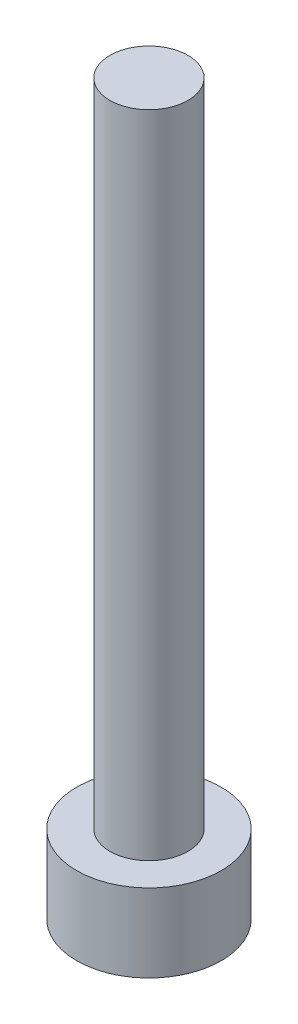
from build123d import *

# Parameters (mm, degrees)
SKETCH1_R           = 2.78
BOSS_EXTRUDE1_DEPTH = 3
SKETCH2_R           = 1.5
BOSS_EXTRUDE2_DEPTH = 25


with BuildPart() as part:
    # Sketch1 → Boss-Extrude1 (new body)
    with BuildSketch(Plane(origin=(0, 0, 0), x_dir=(1, 0, 0), z_dir=(0, 1, 0))):
        with Locations(Location((0, 0, 0), (0, 0, 270))):
            Circle(SKETCH1_R)
    extrude(amount=BOSS_EXTRUDE1_DEPTH)

    # Sketch2 → Boss-Extrude2 (add)
    with BuildSketch(Plane(origin=(0, 3, 0), x_dir=(1, 0, 0), z_dir=(0, 1, 0))):
        with Locations(Location((0, 0, 0), (0, 0, 270))):
            Circle(SKETCH2_R)
    extrude(amount=BOSS_EXTRUDE2_DEPTH)


solid = part.part
